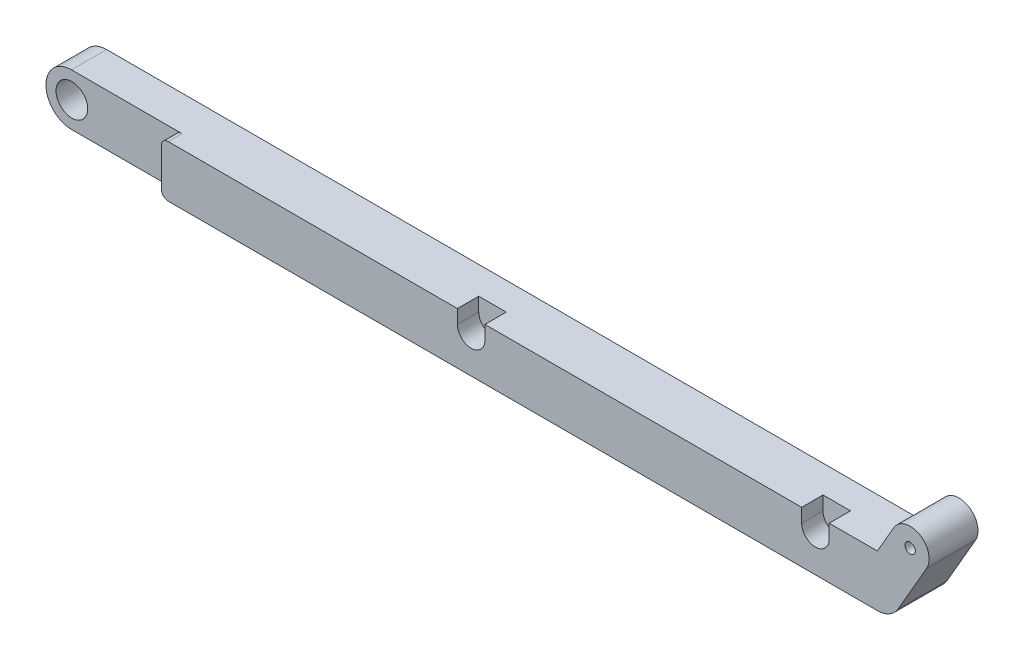
from build123d import *

# Parameters (mm, degrees)
SKETCH1_R           = 4.6
SKETCH1_R_2         = 1.5
BOSS_EXTRUDE1_DEPTH = 10.2
BOSS_EXTRUDE2_DEPTH = 8
SKETCH3_R           = 3.6
CUT_EXTRUDE1_DEPTH  = 5
SKETCH4_R           = 1.5
BOSS_EXTRUDE3_DEPTH = 0.6
SKETCH5_R           = 1.5
BOSS_EXTRUDE4_DEPTH = 4
FILLET1_R           = 2


with BuildPart() as part:
    # Sketch1 → Boss-Extrude1 (new body)
    with BuildSketch(Plane.XY):
        with BuildLine():
            Line((-118.85, 7.5), (-2.75, 7.5))
            Line((-2.75, 7.5), (-2.75, 3.5))
            ThreePointArc((-2.75, 3.5), (1.25, -0.5), (5.25, 3.5))
            Line((5.25, 3.5), (5.25, 7.5))
            Line((5.25, 7.5), (97.25, 7.5))
            Line((97.25, 7.5), (97.25, 3.5))
            ThreePointArc((97.25, 3.5), (101.25, -0.5), (105.25, 3.5))
            Line((105.25, 3.5), (105.25, 7.5))
            Line((105.25, 7.5), (119.25, 7.5))
            Line((119.25, 7.5), (124.013139721, 15.75))
            ThreePointArc((124.013139721, 15.75), (131.526279442, 17.763139721), (133.539419162, 10.25))
            Line((133.539419162, 10.25), (125.312177826, -4))
            ThreePointArc((125.312177826, -4), (122.75, -6.562177826), (119.25, -7.5))
            Line((119.25, -7.5), (-118.85, -7.5))
            ThreePointArc((-118.85, -7.5), (-124.082590181, -5.332590181), (-126.25, -0.1))
            Line((-126.25, -0.1), (-126.25, 0.1))
            ThreePointArc((-126.25, 0.1), (-124.082590181, 5.332590181), (-118.85, 7.5))
        make_face()
        with Locations((-118.75, 0)):
            Circle(SKETCH1_R, mode=Mode.SUBTRACT)
        with Locations((128.776279442, 13)):
            Circle(SKETCH1_R_2, mode=Mode.SUBTRACT)
    extrude(amount=BOSS_EXTRUDE1_DEPTH)

    # Sketch2 → Boss-Extrude2 (add)
    with BuildSketch(Plane(origin=(0, 0, 0), x_dir=(-1, 0, 0), z_dir=(0, 0, -1))):
        with BuildLine():
            Line((-105.25, 3.5), (-105.25, 7.5))
            Line((-105.25, 7.5), (-97.25, 7.5))
            Line((-97.25, 7.5), (-97.25, 3.5))
            ThreePointArc((-97.25, 3.5), (-101.25, -0.5), (-105.25, 3.5))
        make_face()
        with BuildLine():
            Line((-5.25, 3.5), (-5.25, 7.5))
            Line((-5.25, 7.5), (2.75, 7.5))
            Line((2.75, 7.5), (2.75, 3.5))
            ThreePointArc((2.75, 3.5), (-1.25, -0.5), (-5.25, 3.5))
        make_face()
    extrude(amount=-BOSS_EXTRUDE2_DEPTH)

    # Sketch3 → Cut-Extrude1 (cut)
    with BuildSketch(Plane(origin=(0, 0, 0), x_dir=(-1, 0, 0), z_dir=(0, 0, -1))):
        with Locations((-128.776279442, 13)):
            Circle(SKETCH3_R)
    extrude(amount=-CUT_EXTRUDE1_DEPTH, mode=Mode.SUBTRACT)

    # Sketch4 → Boss-Extrude3 (add)
    with BuildSketch(Plane(origin=(0, 0, 5), x_dir=(-1, 0, 0), z_dir=(0, 0, -1))):
        with Locations((-128.776279442, 13)):
            Circle(SKETCH4_R)
    extrude(amount=-BOSS_EXTRUDE3_DEPTH)

    # Sketch5 → Boss-Extrude4 (add)
    with BuildSketch(Plane.XY.offset(10.2)):
        with BuildLine():
            Line((-88.75, 7.5), (-88.75, -7.5))
            Line((-88.75, -7.5), (119.25, -7.5))
            ThreePointArc((119.25, -7.5), (122.75, -6.562177826), (125.312177826, -4))
            Line((125.312177826, -4), (133.539419162, 10.25))
            ThreePointArc((133.539419162, 10.25), (131.526279442, 17.763139721), (124.013139721, 15.75))
            Line((124.013139721, 15.75), (119.25, 7.5))
            Line((119.25, 7.5), (105.25, 7.5))
            Line((105.25, 7.5), (105.25, 3.5))
            ThreePointArc((105.25, 3.5), (101.25, -0.5), (97.25, 3.5))
            Line((97.25, 3.5), (97.25, 7.5))
            Line((97.25, 7.5), (5.25, 7.5))
            Line((5.25, 7.5), (5.25, 3.5))
            ThreePointArc((5.25, 3.5), (1.25, -0.5), (-2.75, 3.5))
            Line((-2.75, 3.5), (-2.75, 7.5))
            Line((-2.75, 7.5), (-88.75, 7.5))
        make_face()
        with Locations(Location((128.776279442, 13, 0), (0, 0, 180))):
            Circle(SKETCH5_R, mode=Mode.SUBTRACT)
    extrude(amount=BOSS_EXTRUDE4_DEPTH)

    # Fillet1
    fillet1_edges = [part.edges().sort_by_distance(p)[0] for p in [
        (-88.75, 7.5, 12.2),
        (-88.75, -7.5, 12.2),
    ]]
    fillet(fillet1_edges, radius=FILLET1_R)


solid = part.part
